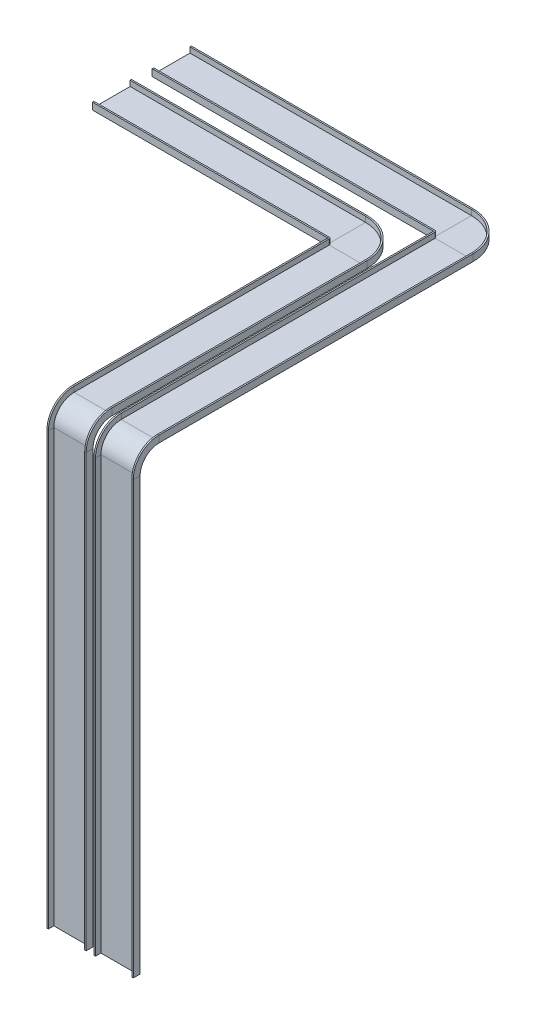
from build123d import *

# Parameters (mm, degrees)
SALIENTE_EXTRUIR1_DEPTH   = 1000
SALIENTE_EXTRUIR1_2_DEPTH = 1000


with BuildPart() as part:
    # Croquis1 → Saliente-Extruir1 (new body)
    with BuildSketch(Plane(origin=(0, 0, 0), x_dir=(1, 0, 0), z_dir=(0, 1, 0))):
        Polygon((-465, 0), (-465, 55), (-95, 55), (-95, 0), (-80, 0), (-80, 70), (-480, 70), (-480, 0), align=None)
    extrude(amount=SALIENTE_EXTRUIR1_DEPTH)

    # Barrer1: sweep along a curve in space
    with BuildLine() as barrer1_path:
        Line((-280, 1000, -62.5), (-280, 4400, -62.5))
        ThreePointArc((-280, 4400, -62.5), (-280, 4541.421356237, -121.078643763), (-280, 4600, -262.5))
        Line((-280, 4600, -262.5), (-280, 4600, -2862.5))
        ThreePointArc((-280, 4600, -2862.5), (-338.578643763, 4600, -3003.921356237), (-480, 4600, -3062.5))
        Line((-480, 4600, -3062.5), (-2880, 4600, -3062.5))
    # Croquis3 → Barrer1 (sweep)
    with BuildSketch(Plane(origin=(0, 1000, 0), x_dir=(1, 0, 0), z_dir=(0, 1, 0))):
        Polygon((-465, 0), (-465, 55), (-95, 55), (-95, 0), (-80, 0), (-80, 70), (-480, 70), (-480, 0), align=None)
    sweep(path=barrer1_path.line)


with BuildPart() as body_2:
    # Croquis1 → Saliente-Extruir1 2 (new body)
    with BuildSketch(Plane(origin=(0, 0, 0), x_dir=(1, 0, 0), z_dir=(0, 1, 0))):
        Polygon((0, 0), (15, 0), (15, 55), (385, 55), (385, 0), (400, 0), (400, 70), (0, 70), align=None)
    extrude(amount=SALIENTE_EXTRUIR1_2_DEPTH)

    # Barrer2: sweep along a curve in space
    with BuildLine() as barrer2_path:
        Line((200, 1000, -62.5), (200, 4400, -62.5))
        ThreePointArc((200, 4400, -62.5), (200, 4541.421356237, -121.078643763), (200, 4600, -262.5))
        Line((200, 4600, -262.5), (200, 4600, -3462.5))
        ThreePointArc((200, 4600, -3462.5), (141.421356237, 4600, -3603.921356237), (0, 4600, -3662.5))
        Line((0, 4600, -3662.5), (-2870, 4600, -3662.5))
    # Croquis4 → Barrer2 (sweep)
    with BuildSketch(Plane(origin=(0, 1000, 0), x_dir=(1, 0, 0), z_dir=(0, 1, 0))):
        Polygon((15, 0), (15, 55), (385, 55), (385, 0), (400, 0), (400, 70), (0, 70), (0, 0), align=None)
    sweep(path=barrer2_path.line)


solid = Compound([part.part, body_2.part])
